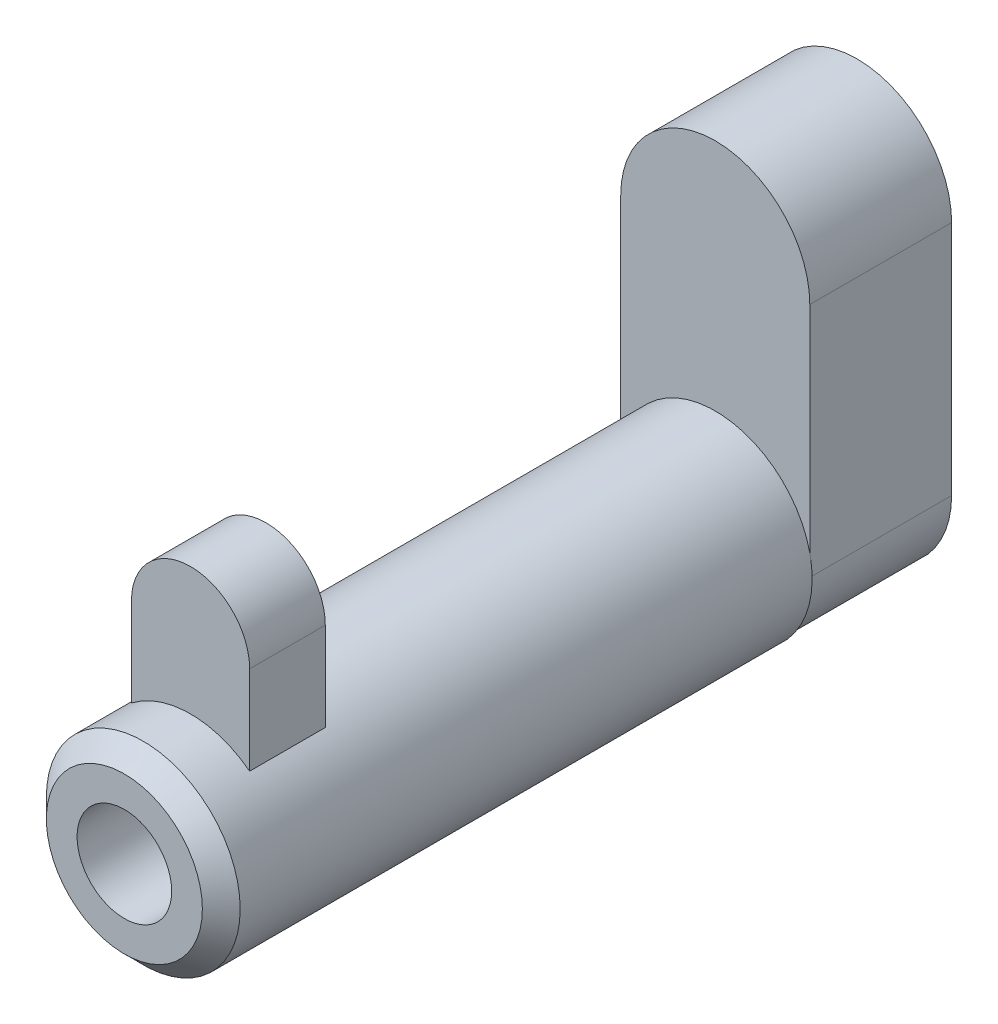
from build123d import *

# Parameters (mm, degrees)
AUFSATZ_LINEAR_AUSTRAGEN1_DEPTH = 3
SKIZZE2_R                       = 2.05
AUFSATZ_LINEAR_AUSTRAGEN2_DEPTH = 12.5
AUFSATZ_LINEAR_START            = 9.5
AUFSATZ_LINEAR_AUSTRAGEN3_DEPTH = 1.6
SCHNITT_LINEAR_AUSTRAGEN1_REACH = 19.13
SKIZZE4_R                       = 1
FASE1_SIZE                      = 0.4


with BuildPart() as part:
    # Skizze1 → Aufsatz-Linear austragen1 (new body)
    with BuildSketch(Plane.XY):
        with BuildLine():
            Line((2, 0), (2, 5))
            ThreePointArc((2, 5), (0, 7), (-2, 5))
            Line((-2, 5), (-2, 0))
            ThreePointArc((-2, 0), (0, -2), (2, 0))
        make_face()
    extrude(amount=AUFSATZ_LINEAR_AUSTRAGEN1_DEPTH)

    # Skizze2 → Aufsatz-Linear austragen2 (add)
    with BuildSketch(Plane.XY.offset(3)):
        with Locations(Location((0, 0, 0), (0, 0, 167.319616508))):
            Circle(SKIZZE2_R)
    extrude(amount=AUFSATZ_LINEAR_AUSTRAGEN2_DEPTH)

    # Skizze3 → Aufsatz-Linear austragen3 (add)
    with BuildSketch(Plane.XY.offset(3).offset(AUFSATZ_LINEAR_START)):
        with BuildLine():
            Line((-1.25, 3.5), (-1.25, 1.624807681))
            ThreePointArc((-1.25, 1.624807681), (0, 2.05), (1.25, 1.624807681))
            Line((1.25, 1.624807681), (1.25, 3.5))
            ThreePointArc((1.25, 3.5), (0, 4.75), (-1.25, 3.5))
        make_face()
    extrude(amount=AUFSATZ_LINEAR_AUSTRAGEN3_DEPTH)

    # Skizze4 → Schnitt-Linear austragen1 (cut, up to next)
    with BuildSketch(Plane.XY.offset(15.5), mode=Mode.PRIVATE) as schnitt_linear_austragen1_sk1:
        Circle(SKIZZE4_R)
    schnitt_linear_austragen1_tool1 = extrude(schnitt_linear_austragen1_sk1.sketch, amount=-SCHNITT_LINEAR_AUSTRAGEN1_REACH, mode=Mode.PRIVATE) & part.part
    add(schnitt_linear_austragen1_tool1.solids().sort_by_distance((0, 0, 15.5))[0], mode=Mode.SUBTRACT)

    # Fase1
    fase1_edges = [part.edges().sort_by_distance(p)[0] for p in [
        (2, -0.45, 15.5),
    ]]
    chamfer(fase1_edges, length=FASE1_SIZE)


solid = part.part
